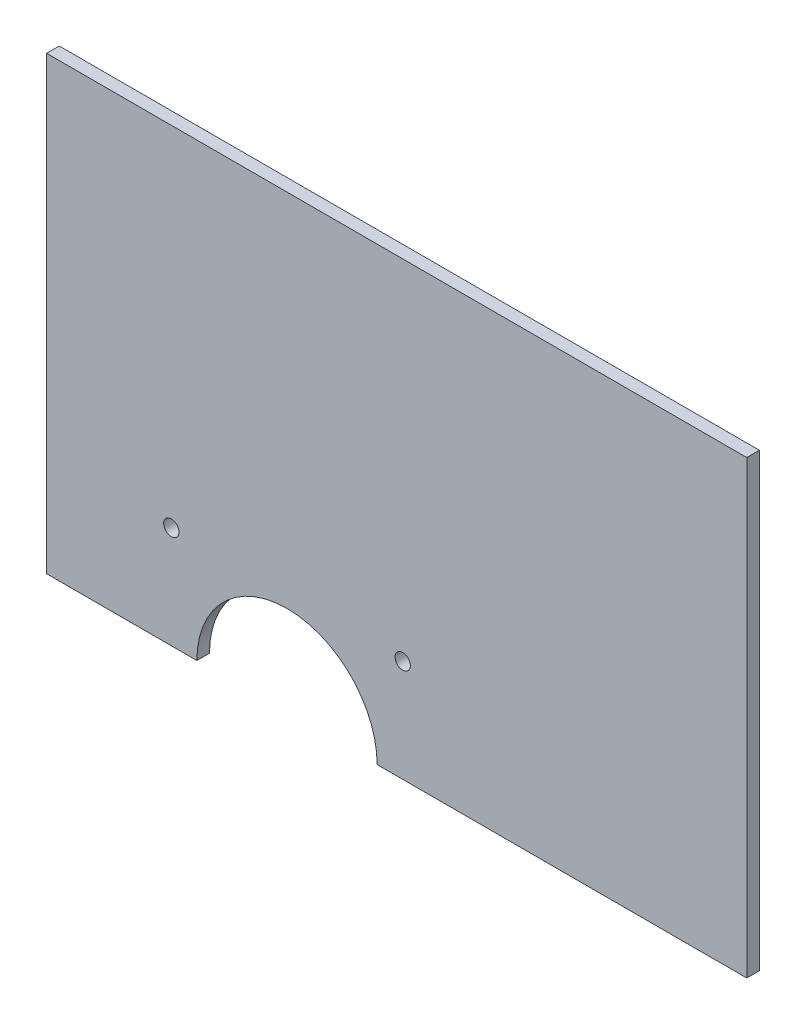
from build123d import *

# Parameters (mm, degrees)
ESQUISSE1_W             = 233
ESQUISSE1_H             = 150
BOSS_EXTRU_1_DEPTH      = 4.2
ESQUISSE2_R             = 2.55
ENL_V_MAT_EXTRU_1_DEPTH = 145.628460094


with BuildPart() as part:
    # Esquisse1 → Boss.-Extru.1 (new body)
    with BuildSketch(Plane.XY):
        with Locations((-3.063037439, -6.267653759)):
            Rectangle(ESQUISSE1_W, ESQUISSE1_H)
    extrude(amount=BOSS_EXTRU_1_DEPTH)

    # Esquisse2 → Enlèv. mat.-Extru.1 (cut, through all)
    with BuildSketch(Plane.XY.offset(4.2)):
        with Locations((-78.063037439, -47.267653759)):
            Circle(ESQUISSE2_R)
        with Locations((-1.063037439, -47.267653759)):
            Circle(ESQUISSE2_R)
        with BuildLine():
            Line((-69.563037439, -81.267653759), (-9.563037439, -81.267653759))
            ThreePointArc((-9.563037439, -81.267653759), (-39.563037439, -51.267653759), (-69.563037439, -81.267653759))
        make_face()
    extrude(amount=-ENL_V_MAT_EXTRU_1_DEPTH, mode=Mode.SUBTRACT)


solid = part.part
